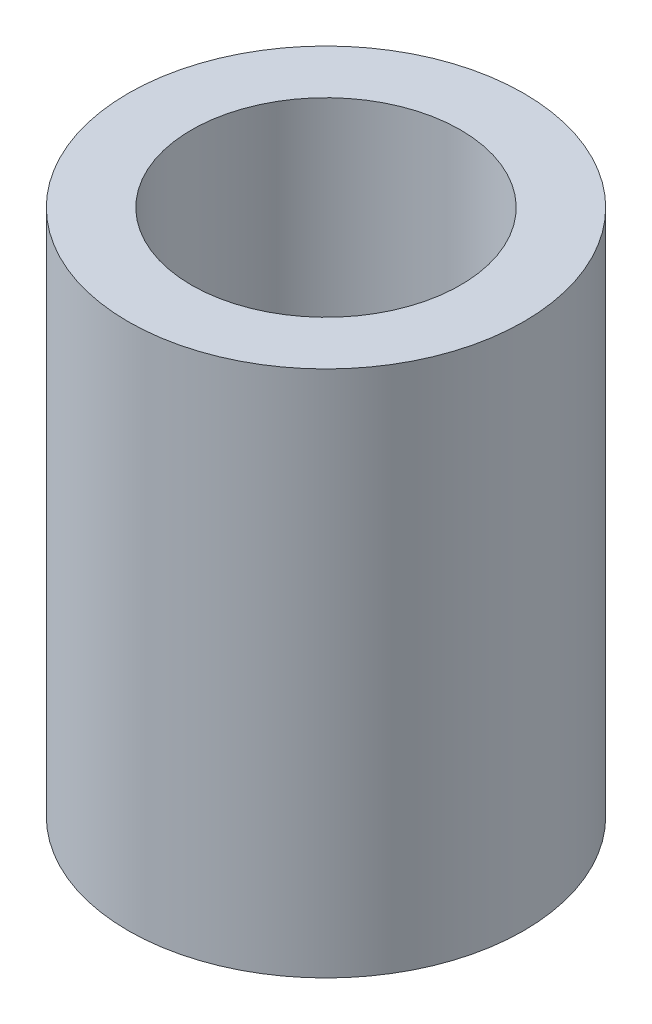
from build123d import *

# Parameters (mm, degrees)
SKETCH1_R           = 4.7625
SKETCH1_R_2         = 3.2385
BOSS_EXTRUDE1_DEPTH = 6.35


with BuildPart() as part:
    # Sketch1 → Boss-Extrude1 (new, symmetric)
    with BuildSketch(Plane(origin=(0, 0, 0), x_dir=(1, 0, 0), z_dir=(0, 1, 0))):
        with Locations(Location((0, 0, 0), (0, 0, 270))):
            Circle(SKETCH1_R)
        with Locations(Location((0, 0, 0), (0, 0, 270))):
            Circle(SKETCH1_R_2, mode=Mode.SUBTRACT)
    extrude(amount=BOSS_EXTRUDE1_DEPTH, both=True)


solid = part.part
